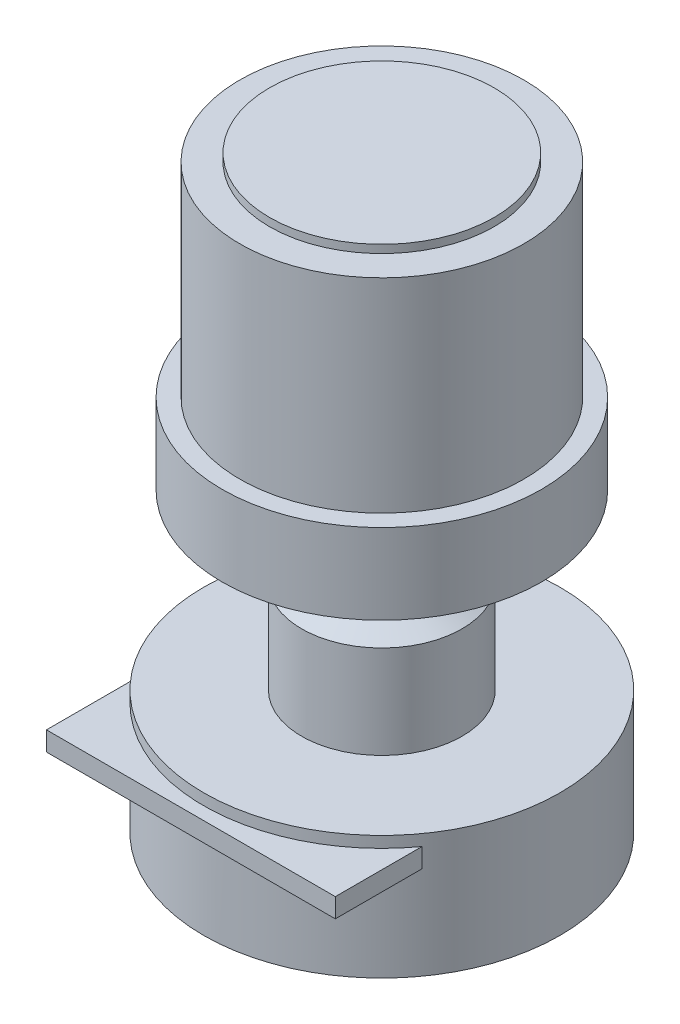
from build123d import *

# Parameters (mm, degrees)
BOSS_EXTRU_1_START = -5.8
BOSS_EXTRU_1_DEPTH = 1.2
ESQUISSE4_R        = 7
BOSS_EXTRU_2_DEPTH = 0.5


with BuildPart() as part:
    # Esquisse2 → Révolution1 (revolve)
    with BuildSketch(Plane.XY, mode=Mode.PRIVATE) as r_volution1_sk:
        Polygon((0, 17.7), (-8.85, 17.7), (-8.85, 5), (-9.95, 5), (-9.95, 0), (-3, 0), (-3, -4), (-5, -5), (-5, -10.8), (-11.1, -10.8), (-11.1, -18.5), (0, -18.5), align=None)
    revolve(r_volution1_sk.sketch.rotate(Axis((0, -55, 0), (0, 1, 0)), 270), axis=Axis((0, -55, 0), (0, 1, 0)))

    # Esquisse3 → Boss.-Extru.1 (add)
    with BuildSketch(Plane.XZ.offset(18.5).offset(BOSS_EXTRU_1_START)):
        with BuildLine():
            Line((-9, 6.496922348), (-9, 11.9))
            Line((-9, 11.9), (9, 11.9))
            Line((9, 11.9), (9, 6.496922348))
            ThreePointArc((9, 6.496922348), (0, 11.1), (-9, 6.496922348))
        make_face()
    extrude(amount=-BOSS_EXTRU_1_DEPTH)

    # Esquisse4 → Boss.-Extru.2 (add)
    with BuildSketch(Plane(origin=(0, 17.7, 0), x_dir=(1, 0, 0), z_dir=(0, 1, 0))):
        with Locations(Location((0, 0, 0), (0, 0, 270))):
            Circle(ESQUISSE4_R)
    extrude(amount=BOSS_EXTRU_2_DEPTH)


solid = part.part
